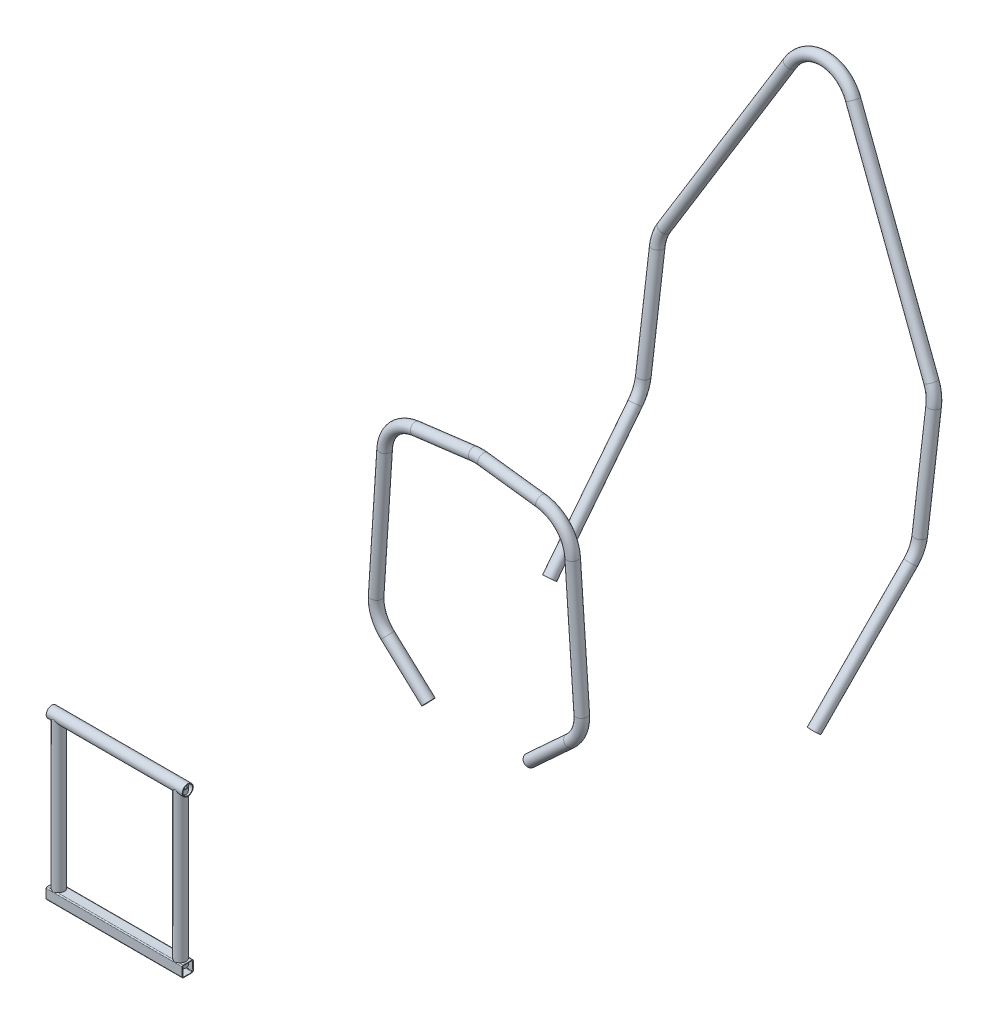
from build123d import *

# Parameters (mm, degrees)
SKETCH1153_R                       = 12.7
SKETCH1153_R_2                     = 10.287
MAIN_ROLL_HOOP_STRUCTURE_DEPTH     = 315.925067867
SKETCH1153_ON_SEGMENT_2_R          = 12.7
SKETCH1153_ON_SEGMENT_2_R_2        = 10.287
MAIN_ROLL_HOOP_STRUCTURE_2_ANGLE   = 34.032598731
SKETCH1153_ON_SEGMENT_3_R          = 12.7
SKETCH1153_ON_SEGMENT_3_R_2        = 10.287
MAIN_ROLL_HOOP_STRUCTURE_3_DEPTH   = 244.437897406
SKETCH1153_ON_SEGMENT_4_R          = 12.7
SKETCH1153_ON_SEGMENT_4_R_2        = 10.287
MAIN_ROLL_HOOP_STRUCTURE_4_ANGLE   = 29.15250341
SKETCH1153_ON_SEGMENT_5_R          = 12.7
SKETCH1153_ON_SEGMENT_5_R_2        = 10.287
MAIN_ROLL_HOOP_STRUCTURE_5_DEPTH   = 482.30897679
SKETCH1153_ON_SEGMENT_6_R          = 12.7
SKETCH1153_ON_SEGMENT_6_R_2        = 10.287
MAIN_ROLL_HOOP_STRUCTURE_6_ANGLE   = 121.694993179
SKETCH1153_ON_SEGMENT_7_R          = 12.7
SKETCH1153_ON_SEGMENT_7_R_2        = 10.287
MAIN_ROLL_HOOP_STRUCTURE_7_DEPTH   = 482.30897679
SKETCH1153_ON_SEGMENT_8_R          = 12.7
SKETCH1153_ON_SEGMENT_8_R_2        = 10.287
MAIN_ROLL_HOOP_STRUCTURE_8_ANGLE   = 29.15250341
SKETCH1153_ON_SEGMENT_9_R          = 12.7
SKETCH1153_ON_SEGMENT_9_R_2        = 10.287
MAIN_ROLL_HOOP_STRUCTURE_9_DEPTH   = 244.437897406
SKETCH1153_ON_SEGMENT_10_R         = 12.7
SKETCH1153_ON_SEGMENT_10_R_2       = 10.287
MAIN_ROLL_HOOP_STRUCTURE_10_ANGLE  = 34.032598731
SKETCH1153_ON_SEGMENT_11_R         = 12.7
SKETCH1153_ON_SEGMENT_11_R_2       = 10.287
MAIN_ROLL_HOOP_STRUCTURE_11_DEPTH  = 315.925067867
SKETCH1172_ON_SEGMENT_1_R          = 12.7
SKETCH1172_ON_SEGMENT_1_R_2        = 10.287
FRONT_ROLL_HOOP_STRUCTURE_DEPTH    = 126.80841641
SKETCH1172_ON_SEGMENT_2_R          = 12.7
SKETCH1172_ON_SEGMENT_2_R_2        = 10.287
FRONT_ROLL_HOOP_STRUCTURE_2_ANGLE  = 51.219059772
SKETCH1172_ON_SEGMENT_3_R          = 12.7
SKETCH1172_ON_SEGMENT_3_R_2        = 10.287
FRONT_ROLL_HOOP_STRUCTURE_3_DEPTH  = 303.286771979
SKETCH1172_ON_SEGMENT_4_R          = 12.7
SKETCH1172_ON_SEGMENT_4_R_2        = 10.287
FRONT_ROLL_HOOP_STRUCTURE_4_ANGLE  = 79.009756255
SKETCH1172_ON_SEGMENT_5_R          = 12.7
SKETCH1172_ON_SEGMENT_5_R_2        = 10.287
FRONT_ROLL_HOOP_STRUCTURE_5_DEPTH  = 134.584466623
SKETCH1172_ON_SEGMENT_6_R          = 12.7
SKETCH1172_ON_SEGMENT_6_R_2        = 10.287
FRONT_ROLL_HOOP_STRUCTURE_6_ANGLE  = 14.325932886
SKETCH1172_ON_SEGMENT_7_R          = 12.7
SKETCH1172_ON_SEGMENT_7_R_2        = 10.287
FRONT_ROLL_HOOP_STRUCTURE_7_DEPTH  = 134.584466623
SKETCH1172_ON_SEGMENT_8_R          = 12.7
SKETCH1172_ON_SEGMENT_8_R_2        = 10.287
FRONT_ROLL_HOOP_STRUCTURE_8_ANGLE  = 79.009756255
SKETCH1172_ON_SEGMENT_9_R          = 12.7
SKETCH1172_ON_SEGMENT_9_R_2        = 10.287
FRONT_ROLL_HOOP_STRUCTURE_9_DEPTH  = 303.286771979
SKETCH1172_ON_SEGMENT_10_R         = 12.7
SKETCH1172_ON_SEGMENT_10_R_2       = 10.287
FRONT_ROLL_HOOP_STRUCTURE_10_ANGLE = 51.219059772
SKETCH1172_R                       = 12.7
SKETCH1172_R_2                     = 10.287
FRONT_ROLL_HOOP_STRUCTURE_11_DEPTH = 126.80841641
FRONT_BULKHEAD_LOWER_DEPTH         = 312.42
SKETCH126_R                        = 12.7
SKETCH126_R_2                      = 11.049
FRONT_BULKHEAD_SIDE_DEPTH          = 355.6
SKETCH126_ON_SEGMENT_2_R           = 12.7
SKETCH126_ON_SEGMENT_2_R_2         = 11.049
FRONT_BULKHEAD_SIDE_2_DEPTH        = 355.6
SKETCH127_R                        = 12.7
SKETCH127_R_2                      = 11.049
FRONT_BULKHEAD_UPPER_DEPTH         = 312.42


with BuildPart() as part:
    # Sketch1153 → Main Roll Hoop Structure (new body)
    with BuildSketch(Plane(origin=(303.778494541, 44.481306824, -647.810870849), x_dir=(0.9952203235825845, -0.08898944049055654, -0.04021675035795001), z_dir=(0.04021675035795001, 0.7487674478678381, -0.6616116096352382))):
        Circle(SKETCH1153_R)
        Circle(SKETCH1153_R_2, mode=Mode.SUBTRACT)
    extrude(amount=MAIN_ROLL_HOOP_STRUCTURE_DEPTH)


with BuildPart() as body_2:
    # Sketch1153 on segment 2 (carried to the start of arc 2) → Main Roll Hoop Structure 2 (revolve)
    with BuildSketch(Plane(origin=(317.5, 325, -876.842933853), x_dir=(0.975736887, 0.02857824, 0.217073288), z_dir=(0, -0.991444861, 0.130526192))):
        Circle(SKETCH1153_ON_SEGMENT_2_R)
        Circle(SKETCH1153_ON_SEGMENT_2_R_2, mode=Mode.SUBTRACT)
    revolve(axis=Axis((311.56806622, 335.747082056, -795.210741129), (-0.997414824, -0.009379439, -0.071243916)), revolution_arc=MAIN_ROLL_HOOP_STRUCTURE_2_ANGLE)


with BuildPart() as body_3:
    # Sketch1153 on segment 3 (carried to segment 3) → Main Roll Hoop Structure 3 (new body)
    with BuildSketch(Plane(origin=(317.5, 567.346697308, -908.748481836), x_dir=(0.975736887, 0.02857824, 0.217073288), z_dir=(0, -0.991444861, 0.130526192))):
        Circle(SKETCH1153_ON_SEGMENT_3_R)
        Circle(SKETCH1153_ON_SEGMENT_3_R_2, mode=Mode.SUBTRACT)
    extrude(amount=MAIN_ROLL_HOOP_STRUCTURE_3_DEPTH)


with BuildPart() as body_4:
    # Sketch1153 on segment 4 (carried to the start of arc 4) → Main Roll Hoop Structure 4 (revolve)
    with BuildSketch(Plane(origin=(307.043077746, 607.21573451, -913.99734016), x_dir=(0.00187339, 0.131561917, 0.991306185), z_dir=(0.487135864, -0.865854773, 0.113991943))):
        Circle(SKETCH1153_ON_SEGMENT_4_R)
        Circle(SKETCH1153_ON_SEGMENT_4_R_2, mode=Mode.SUBTRACT)
    revolve(axis=Axis((234.95, 567.346697308, -908.748481836), (0, -0.130526192, -0.991444861)), revolution_arc=MAIN_ROLL_HOOP_STRUCTURE_4_ANGLE)


with BuildPart() as body_5:
    # Sketch1153 on segment 5 (carried to segment 5) → Main Roll Hoop Structure 5 (new body)
    with BuildSketch(Plane(origin=(72.093077746, 1024.825263895, -968.97667772), x_dir=(0.00187339, 0.131561917, 0.991306185), z_dir=(0.487135864, -0.865854773, 0.113991943))):
        Circle(SKETCH1153_ON_SEGMENT_5_R)
        Circle(SKETCH1153_ON_SEGMENT_5_R_2, mode=Mode.SUBTRACT)
    extrude(amount=MAIN_ROLL_HOOP_STRUCTURE_5_DEPTH)


with BuildPart() as body_6:
    # Sketch1153 on segment 6 (carried to the start of arc 6) → Main Roll Hoop Structure 6 (revolve)
    with BuildSketch(Plane(origin=(72.093077746, 1024.825263895, -968.97667772), x_dir=(0.849073157, 0.439008704, -0.293847124), z_dir=(-0.487135864, 0.865854773, -0.113991943))):
        Circle(SKETCH1153_ON_SEGMENT_6_R)
        Circle(SKETCH1153_ON_SEGMENT_6_R_2, mode=Mode.SUBTRACT)
    revolve(axis=Axis((0, 984.956226694, -963.727819396), (0, 0.130526192, 0.991444861)), revolution_arc=MAIN_ROLL_HOOP_STRUCTURE_6_ANGLE)


with BuildPart() as body_7:
    # Sketch1153 on segment 7 (carried to segment 7) → Main Roll Hoop Structure 7 (new body)
    with BuildSketch(Plane(origin=(-72.093077746, 1024.825263895, -968.97667772), x_dir=(0.277236263, -0.277092456, -0.919978166), z_dir=(-0.487135864, -0.865854773, 0.113991943))):
        Circle(SKETCH1153_ON_SEGMENT_7_R)
        Circle(SKETCH1153_ON_SEGMENT_7_R_2, mode=Mode.SUBTRACT)
    extrude(amount=MAIN_ROLL_HOOP_STRUCTURE_7_DEPTH)


with BuildPart() as body_8:
    # Sketch1153 on segment 8 (carried to the start of arc 8) → Main Roll Hoop Structure 8 (revolve)
    with BuildSketch(Plane(origin=(-317.5, 567.346697308, -908.748481836), x_dir=(0.997045173, -0.010026692, -0.076160283), z_dir=(0, 0.991444861, -0.130526192))):
        Circle(SKETCH1153_ON_SEGMENT_8_R)
        Circle(SKETCH1153_ON_SEGMENT_8_R_2, mode=Mode.SUBTRACT)
    revolve(axis=Axis((-234.95, 567.346697308, -908.748481836), (0, -0.130526192, -0.991444861)), revolution_arc=MAIN_ROLL_HOOP_STRUCTURE_8_ANGLE)


with BuildPart() as body_9:
    # Sketch1153 on segment 9 (carried to segment 9) → Main Roll Hoop Structure 9 (new body)
    with BuildSketch(Plane(origin=(-317.5, 567.346697308, -908.748481836), x_dir=(0.975736887, 0.02857824, 0.217073288), z_dir=(0, -0.991444861, 0.130526192))):
        Circle(SKETCH1153_ON_SEGMENT_9_R)
        Circle(SKETCH1153_ON_SEGMENT_9_R_2, mode=Mode.SUBTRACT)
    extrude(amount=MAIN_ROLL_HOOP_STRUCTURE_9_DEPTH)


with BuildPart() as body_10:
    # Sketch1153 on segment 10 (carried to the start of arc 10) → Main Roll Hoop Structure 10 (revolve)
    with BuildSketch(Plane(origin=(-317.5, 325, -876.842933853), x_dir=(0.975736887, 0.02857824, 0.217073288), z_dir=(0, -0.991444861, 0.130526192))):
        Circle(SKETCH1153_ON_SEGMENT_10_R)
        Circle(SKETCH1153_ON_SEGMENT_10_R_2, mode=Mode.SUBTRACT)
    revolve(axis=Axis((-311.56806622, 335.747082056, -795.210741129), (-0.997414824, 0.009379439, 0.071243916)), revolution_arc=MAIN_ROLL_HOOP_STRUCTURE_10_ANGLE)


with BuildPart() as body_11:
    # Sketch1153 on segment 11 (carried to segment 11) → Main Roll Hoop Structure 11 (new body)
    with BuildSketch(Plane(origin=(-303.778494541, 44.481306824, -647.810870849), x_dir=(0.995220324, -0.028954214, -0.093263932), z_dir=(-0.04021675, 0.748767448, -0.66161161))):
        Circle(SKETCH1153_ON_SEGMENT_11_R)
        Circle(SKETCH1153_ON_SEGMENT_11_R_2, mode=Mode.SUBTRACT)
    extrude(amount=MAIN_ROLL_HOOP_STRUCTURE_11_DEPTH)


with BuildPart() as part_1:
    add(part.part)

    # Main Roll Hoop Structure as one body: union body 2, body 3, body 4, body 5, body 6, body 7, body 8, body 9, body 10, body 11
    add(body_2.part)
    add(body_3.part)
    add(body_4.part)
    add(body_5.part)
    add(body_6.part)
    add(body_7.part)
    add(body_8.part)
    add(body_9.part)
    add(body_10.part)
    add(body_11.part)


with BuildPart() as body_2_2:
    # Sketch1172 on segment 1 (carried to segment 1) → Front Roll Hoop Structure (new body)
    with BuildSketch(Plane(origin=(116.332, 124.555900457, -182.06834945), x_dir=(-0.676981536, 0.735997801, 0.001799194), z_dir=(0.736, 0.676979513, 0.00165492))):
        Circle(SKETCH1172_ON_SEGMENT_1_R)
        Circle(SKETCH1172_ON_SEGMENT_1_R_2, mode=Mode.SUBTRACT)
    extrude(amount=FRONT_ROLL_HOOP_STRUCTURE_DEPTH)


with BuildPart() as body_3_2:
    # Sketch1172 on segment 2 (carried to the start of arc 2) → Front Roll Hoop Structure 2 (revolve)
    with BuildSketch(Plane(origin=(236.144065975, 276.669326214, -181.696498346), x_dir=(0.997769804, 0.066748725, 0.000163172), z_dir=(0.066748925, -0.997766822, -0.002439106))):
        Circle(SKETCH1172_ON_SEGMENT_2_R)
        Circle(SKETCH1172_ON_SEGMENT_2_R_2, mode=Mode.SUBTRACT)
    revolve(axis=Axis((153.778168686, 271.159218925, -181.709968159), (0, 0.002444557, -0.999997012)), revolution_arc=FRONT_ROLL_HOOP_STRUCTURE_2_ANGLE)


with BuildPart() as body_4_2:
    # Sketch1172 on segment 3 (carried to segment 3) → Front Roll Hoop Structure 3 (new body)
    with BuildSketch(Plane(origin=(215.9, 579.278804953, -180.956749908), x_dir=(0.997769804, 0.066748725, 0.000163172), z_dir=(0.066748925, -0.997766822, -0.002439106))):
        Circle(SKETCH1172_ON_SEGMENT_3_R)
        Circle(SKETCH1172_ON_SEGMENT_3_R_2, mode=Mode.SUBTRACT)
    extrude(amount=FRONT_ROLL_HOOP_STRUCTURE_3_DEPTH)


with BuildPart() as body_5_2:
    # Sketch1172 on segment 4 (carried to the start of arc 4) → Front Roll Hoop Structure 4 (revolve)
    with BuildSketch(Plane(origin=(143.827422907, 655.674191802, -180.769996446), x_dir=(0.124691947, 0.99219254, 0.002425479), z_dir=(0.992195504, -0.124691574, -0.000304817))):
        Circle(SKETCH1172_ON_SEGMENT_4_R)
        Circle(SKETCH1172_ON_SEGMENT_4_R_2, mode=Mode.SUBTRACT)
    revolve(axis=Axis((133.534102711, 573.768697664, -180.970219722), (0, 0.002444557, -0.999997012)), revolution_arc=FRONT_ROLL_HOOP_STRUCTURE_4_ANGLE)


with BuildPart() as body_6_2:
    # Sketch1172 on segment 5 (carried to segment 5) → Front Roll Hoop Structure 5 (new body)
    with BuildSketch(Plane(origin=(143.827422907, 655.674191802, -180.769996446), x_dir=(-0.124691947, -0.99219254, -0.002425479), z_dir=(-0.992195504, 0.124691574, 0.000304817))):
        Circle(SKETCH1172_ON_SEGMENT_5_R)
        Circle(SKETCH1172_ON_SEGMENT_5_R_2, mode=Mode.SUBTRACT)
    extrude(amount=FRONT_ROLL_HOOP_STRUCTURE_5_DEPTH)


with BuildPart() as body_7_2:
    # Sketch1172 on segment 6 (carried to the start of arc 6) → Front Roll Hoop Structure 6 (revolve)
    with BuildSketch(Plane(origin=(10.293320196, 672.455740792, -180.728972864), x_dir=(-0.124691947, -0.99219254, -0.002425479), z_dir=(-0.992195504, 0.124691574, 0.000304817))):
        Circle(SKETCH1172_ON_SEGMENT_6_R)
        Circle(SKETCH1172_ON_SEGMENT_6_R_2, mode=Mode.SUBTRACT)
    revolve(axis=Axis((0, 590.550246654, -180.92919614), (0, -0.002444557, 0.999997012)), revolution_arc=FRONT_ROLL_HOOP_STRUCTURE_6_ANGLE)


with BuildPart() as body_8_2:
    # Sketch1172 on segment 7 (carried to segment 7) → Front Roll Hoop Structure 7 (new body)
    with BuildSketch(Plane(origin=(-10.293320196, 672.455740792, -180.728972864), x_dir=(0.124691947, -0.99219254, -0.002425479), z_dir=(-0.992195504, -0.124691574, -0.000304817))):
        Circle(SKETCH1172_ON_SEGMENT_7_R)
        Circle(SKETCH1172_ON_SEGMENT_7_R_2, mode=Mode.SUBTRACT)
    extrude(amount=FRONT_ROLL_HOOP_STRUCTURE_7_DEPTH)


with BuildPart() as body_9_2:
    # Sketch1172 on segment 8 (carried to the start of arc 8) → Front Roll Hoop Structure 8 (revolve)
    with BuildSketch(Plane(origin=(-215.9, 579.278804953, -180.956749908), x_dir=(-0.997769804, 0.066748725, 0.000163172), z_dir=(0.066748925, 0.997766822, 0.002439106))):
        Circle(SKETCH1172_ON_SEGMENT_8_R)
        Circle(SKETCH1172_ON_SEGMENT_8_R_2, mode=Mode.SUBTRACT)
    revolve(axis=Axis((-133.534102711, 573.768697664, -180.970219722), (0, 0.002444557, -0.999997012)), revolution_arc=FRONT_ROLL_HOOP_STRUCTURE_8_ANGLE)


with BuildPart() as body_10_2:
    # Sketch1172 on segment 9 (carried to segment 9) → Front Roll Hoop Structure 9 (new body)
    with BuildSketch(Plane(origin=(-215.9, 579.278804953, -180.956749908), x_dir=(0.997769804, -0.066748725, -0.000163172), z_dir=(-0.066748925, -0.997766822, -0.002439106))):
        Circle(SKETCH1172_ON_SEGMENT_9_R)
        Circle(SKETCH1172_ON_SEGMENT_9_R_2, mode=Mode.SUBTRACT)
    extrude(amount=FRONT_ROLL_HOOP_STRUCTURE_9_DEPTH)


with BuildPart() as body_11_2:
    # Sketch1172 on segment 10 (carried to the start of arc 10) → Front Roll Hoop Structure 10 (revolve)
    with BuildSketch(Plane(origin=(-236.144065975, 276.669326214, -181.696498346), x_dir=(0.997769804, -0.066748725, -0.000163172), z_dir=(-0.066748925, -0.997766822, -0.002439106))):
        Circle(SKETCH1172_ON_SEGMENT_10_R)
        Circle(SKETCH1172_ON_SEGMENT_10_R_2, mode=Mode.SUBTRACT)
    revolve(axis=Axis((-153.778168686, 271.159218925, -181.709968159), (0, -0.002444557, 0.999997012)), revolution_arc=FRONT_ROLL_HOOP_STRUCTURE_10_ANGLE)


with BuildPart() as body_12:
    # Sketch1172 → Front Roll Hoop Structure 11 (new body)
    with BuildSketch(Plane(origin=(-209.662994477, 210.402600463, -181.858491641), x_dir=(0.6769815359372781, 0.7359978008799946, 0.0017991942129510702), z_dir=(0.7360000000000028, -0.6769795131605921, -0.00165492019257211))):
        Circle(SKETCH1172_R)
        Circle(SKETCH1172_R_2, mode=Mode.SUBTRACT)
    extrude(amount=FRONT_ROLL_HOOP_STRUCTURE_11_DEPTH)


with BuildPart() as body_2_2_1:
    add(body_2_2.part)

    # Front Roll Hoop Structure as one body: union body 3 2, body 4 2, body 5 2, body 6 2, body 7 2, body 8 2, body 9 2, body 10 2, body 11 2, body 12
    add(body_3_2.part)
    add(body_4_2.part)
    add(body_5_2.part)
    add(body_6_2.part)
    add(body_7_2.part)
    add(body_8_2.part)
    add(body_9_2.part)
    add(body_10_2.part)
    add(body_11_2.part)
    add(body_12.part)


with BuildPart() as body_3_3:
    # Sketch123 → Front Bulkhead Lower (new body)
    with BuildSketch(Plane(origin=(-156.21, 142.762362322, 643.477647564), x_dir=(0, 0.003982601669673125, -0.9999920694105233), z_dir=(1, 0, 0))):
        with BuildLine():
            Line((-12.7, 10.3378), (-12.7, -10.3378))
            ThreePointArc((-12.7, -10.3378), (-12.008127639, -12.008127639), (-10.3378, -12.7))
            Line((-10.3378, -12.7), (10.3378, -12.7))
            ThreePointArc((10.3378, -12.7), (12.008127639, -12.008127639), (12.7, -10.3378))
            Line((12.7, -10.3378), (12.7, 10.3378))
            ThreePointArc((12.7, 10.3378), (12.008127639, 12.008127639), (10.3378, 12.7))
            Line((10.3378, 12.7), (-10.3378, 12.7))
            ThreePointArc((-10.3378, 12.7), (-12.008127639, 12.008127639), (-12.7, 10.3378))
        make_face()
        with BuildLine():
            Line((-11.4554, 10.3378), (-11.4554, -10.3378))
            ThreePointArc((-11.4554, -10.3378), (-11.128062539, -11.128062539), (-10.3378, -11.4554))
            Line((-10.3378, -11.4554), (10.3378, -11.4554))
            ThreePointArc((10.3378, -11.4554), (11.128062539, -11.128062539), (11.4554, -10.3378))
            Line((11.4554, -10.3378), (11.4554, 10.3378))
            ThreePointArc((11.4554, 10.3378), (11.128062539, 11.128062539), (10.3378, 11.4554))
            Line((10.3378, 11.4554), (-10.3378, 11.4554))
            ThreePointArc((-10.3378, 11.4554), (-11.128062539, 11.128062539), (-11.4554, 10.3378))
        make_face(mode=Mode.SUBTRACT)
    extrude(amount=FRONT_BULKHEAD_LOWER_DEPTH)


with BuildPart() as body_4_3:
    # Sketch126 → Front Bulkhead Side (new body)
    with BuildSketch(Plane(origin=(-139.7, 498.362362322, 643.477647564), x_dir=(1, 0, 0), z_dir=(0, -1, 0))):
        Circle(SKETCH126_R)
        Circle(SKETCH126_R_2, mode=Mode.SUBTRACT)
    extrude(amount=FRONT_BULKHEAD_SIDE_DEPTH)


with BuildPart() as body_5_3:
    # Sketch126 on segment 2 (carried to segment 2) → Front Bulkhead Side 2 (new body)
    with BuildSketch(Plane(origin=(139.7, 498.362362322, 643.477647564), x_dir=(1, 0, 0), z_dir=(0, -1, 0))):
        Circle(SKETCH126_ON_SEGMENT_2_R)
        Circle(SKETCH126_ON_SEGMENT_2_R_2, mode=Mode.SUBTRACT)
    extrude(amount=FRONT_BULKHEAD_SIDE_2_DEPTH)


with BuildPart() as body_6_3:
    # Sketch127 → Front Bulkhead Upper (new body)
    with BuildSketch(Plane(origin=(-156.21, 498.362362322, 643.477647564), x_dir=(0, 1, 0), z_dir=(1, 0, 0))):
        Circle(SKETCH127_R)
        Circle(SKETCH127_R_2, mode=Mode.SUBTRACT)
    extrude(amount=FRONT_BULKHEAD_UPPER_DEPTH)


solid = Compound([part_1.part, body_2_2_1.part, body_3_3.part, body_4_3.part, body_5_3.part, body_6_3.part])
